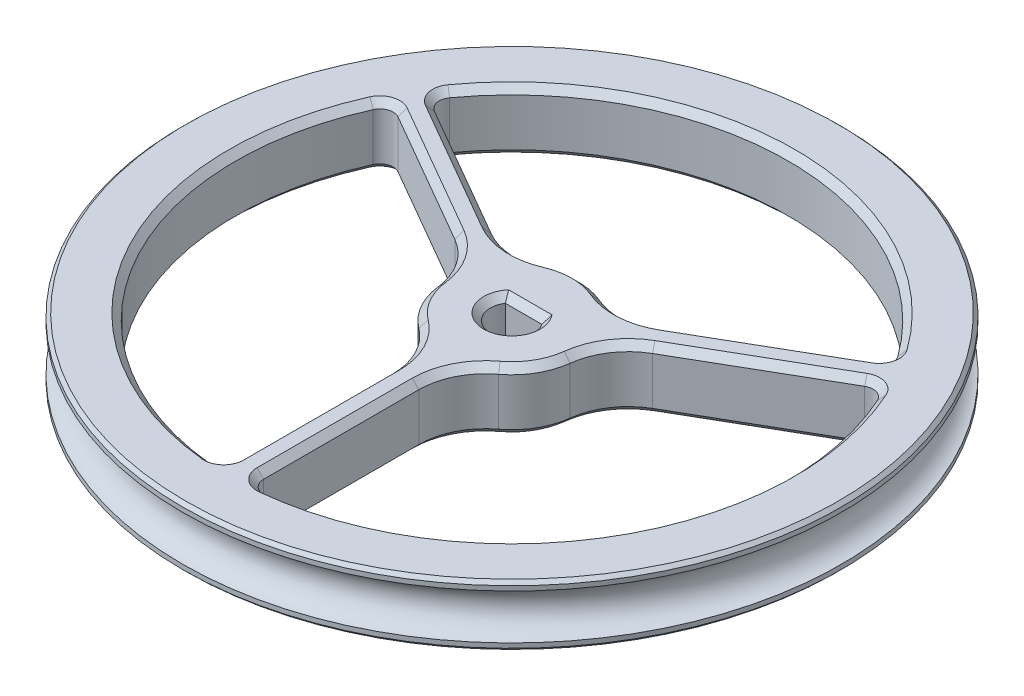
from build123d import *

# Parameters (mm, degrees)
SKETCH1_R           = 24.765
BOSS_EXTRUDE1_DEPTH = 2.286
SKETCH2_R           = 1.7145
CUT_EXTRUDE1_DEPTH  = 36.320159031
CUT_EXTRUDE2_DEPTH  = 36.320159031
CIRPATTERN1_COUNT   = 3
FILLET1_R           = 5
FILLET4_R           = 1
CHAMFER1_SIZE       = 0.5
CHAMFER2_SIZE       = 0.5
CHAMFER3_SIZE       = 0.25


with BuildPart() as part:
    # Sketch1 → Boss-Extrude1 (new, symmetric)
    with BuildSketch(Plane(origin=(0, 0, 0), x_dir=(1, 0, 0), z_dir=(0, 1, 0))):
        with Locations(Location((0, 0, 0), (0, 0, 270))):
            Circle(SKETCH1_R)
    extrude(amount=BOSS_EXTRUDE1_DEPTH, both=True)

    # Sketch2 → Cut-Revolve1 (revolve, cut)
    with BuildSketch(Plane(origin=(0, 0, 0), x_dir=(0, 0, -1), z_dir=(1, 0, 0))):
        with Locations((25.065, 0)):
            Circle(SKETCH2_R)
    revolve(axis=Axis((0, 0, 0), (0, 1, 0)), mode=Mode.SUBTRACT)

    # Sketch3 → Cut-Extrude1 (cut, through all)
    with BuildSketch(Plane(origin=(0, 2.286, 0), x_dir=(1, 0, 0), z_dir=(0, 1, 0))):
        with BuildLine():
            Line((1.372953022, 0.873), (-1.372953022, 0.873))
            ThreePointArc((-1.372953022, 0.873), (0, -1.627), (1.372953022, 0.873))
        make_face()
    extrude(amount=-CUT_EXTRUDE1_DEPTH, mode=Mode.SUBTRACT)

    # Sketch4 → Cut-Extrude2 (cut, through all)
    with BuildSketch(Plane(origin=(0, 2.286, 0), x_dir=(1, 0, 0), z_dir=(0, 1, 0))):
        with BuildLine():
            Line((3.742640687, 3.315515147), (17.462152397, 11.236478926))
            ThreePointArc((17.462152397, 11.236478926), (0, 20.765), (-17.462152397, 11.236478926))
            Line((-17.462152397, 11.236478926), (-3.742640687, 3.315515147))
            ThreePointArc((-3.742640687, 3.315515147), (0, 5), (3.742640687, 3.315515147))
        make_face()
    cut_extrude2 = extrude(amount=-CUT_EXTRUDE2_DEPTH, mode=Mode.SUBTRACT)

    # CirPattern1: Cut-Extrude2 ×3 about axis
    cirpattern1_axis = Axis((0, 0, 0), (0, 1, 0))
    for i in range(1, CIRPATTERN1_COUNT):
        add(cut_extrude2.rotate(cirpattern1_axis, i * 360 / CIRPATTERN1_COUNT), mode=Mode.SUBTRACT)

    # Fillet1
    fillet1_edges = [part.edges().sort_by_distance(p)[0] for p in [
        (3.742640687, 0, -3.315515147),
        (-3.742640687, 0, -3.315515147),
        (1, 0, 4.898979486),
        (4.742640687, 0, -1.583464339),
        (-4.742640687, 0, -1.583464339),
        (-1, 0, 4.898979486),
    ]]
    fillet(fillet1_edges, radius=FILLET1_R)

    # Fillet4
    fillet4_edges = [part.edges().sort_by_distance(p)[0] for p in [
        (-17.462152397, 0, -11.236478926),
        (17.462152397, 0, -11.236478926),
        (18.462152397, 0, -9.504428118),
        (1, 0, 20.740907044),
        (-1, 0, 20.740907044),
        (-18.462152397, 0, -9.504428118),
    ]]
    fillet(fillet4_edges, radius=FILLET4_R)

    # Chamfer1
    chamfer1_edges = [part.edges().sort_by_distance(p)[0] for p in [
        (0, -2.286, -0.873),
        (0, -2.286, 1.627),
        (0, 2.286, -0.873),
        (0, 2.286, 1.627),
    ]]
    chamfer(chamfer1_edges, length=CHAMFER1_SIZE)

    # Chamfer2
    chamfer2_edges = [part.edges().sort_by_distance(p)[0] for p in [
        (12.47866882, 2.286, -6.049862264),
        (12.47866882, -2.286, -6.049862264),
        (17.98301751, 2.286, 10.3825),
        (17.98301751, -2.286, 10.3825),
        (-17.98301751, 2.286, 10.3825),
        (-17.98301751, -2.286, 10.3825),
        (-11.47866882, 2.286, -7.781913072),
        (-11.47866882, -2.286, -7.781913072),
        (-1, 2.286, 13.831775336),
        (-1, -2.286, 13.831775336),
        (17.006931622, 2.286, -11.354272778),
        (17.006931622, -2.286, -11.354272778),
        (18.336554478, 2.286, -9.051298436),
        (18.336554478, -2.286, -9.051298436),
        (-18.336554478, 2.286, -9.051298436),
        (-18.336554478, -2.286, -9.051298436),
        (-17.006931622, 2.286, -11.354272778),
        (-17.006931622, -2.286, -11.354272778),
        (1.329622856, 2.286, 20.405571214),
        (1.329622856, -2.286, 20.405571214),
        (-1.329622856, 2.286, 20.405571214),
        (-1.329622856, -2.286, 20.405571214),
        (11.47866882, 2.286, -7.781913072),
        (11.47866882, -2.286, -7.781913072),
        (0, 2.286, -5),
        (0, -2.286, -5),
        (4.330127019, 2.286, 2.5),
        (4.330127019, -2.286, 2.5),
        (1, 2.286, 13.831775336),
        (1, -2.286, 13.831775336),
        (-4.330127019, 2.286, 2.5),
        (-4.330127019, -2.286, 2.5),
        (-12.47866882, 2.286, -6.049862264),
        (-12.47866882, -2.286, -6.049862264),
        (4.227779535, 2.286, -4.205135088),
        (4.227779535, -2.286, -4.205135088),
        (-4.227779535, 2.286, -4.205135088),
        (-4.227779535, -2.286, -4.205135088),
        (5.75564358, 2.286, -1.558796935),
        (5.75564358, -2.286, -1.558796935),
        (1.527864045, 2.286, 5.763932023),
        (1.527864045, -2.286, 5.763932023),
        (-1.527864045, 2.286, 5.763932023),
        (-1.527864045, -2.286, 5.763932023),
        (-5.75564358, 2.286, -1.558796935),
        (-5.75564358, -2.286, -1.558796935),
        (0, 2.286, -20.765),
        (0, -2.286, -20.765),
    ]]
    chamfer(chamfer2_edges, length=CHAMFER2_SIZE)

    # Chamfer3
    chamfer3_edges = [part.edges().sort_by_distance(p)[0] for p in [
        (0, -2.286, -24.765),
        (0, 2.286, -24.765),
    ]]
    chamfer(chamfer3_edges, length=CHAMFER3_SIZE)


solid = part.part
